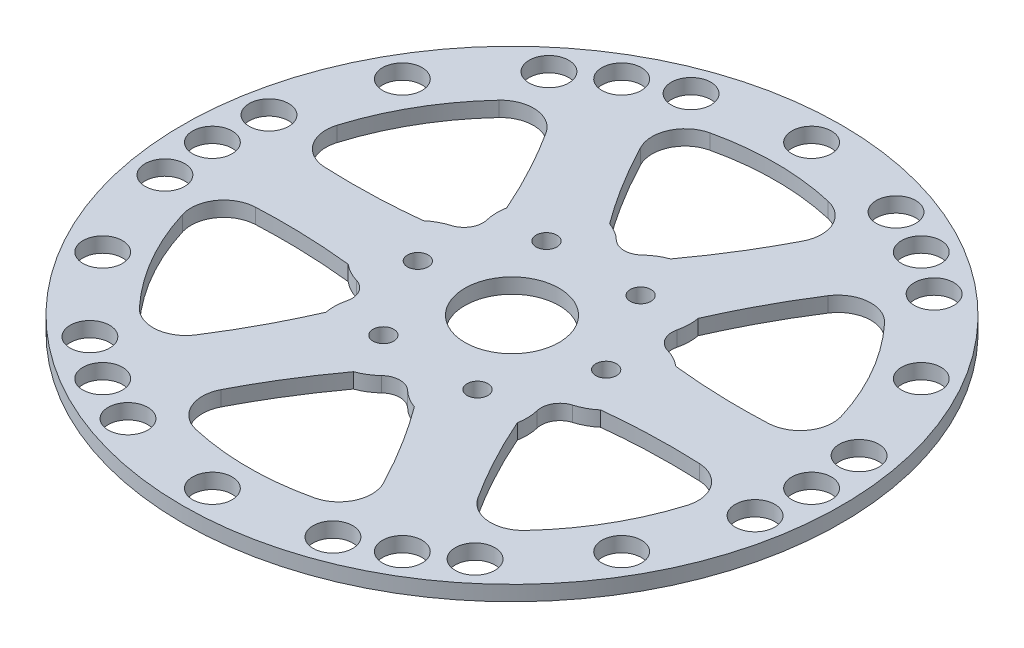
from build123d import *

# Parameters (mm, degrees)
SKETCH1_R           = 35
SKETCH1_R_2         = 5
SKETCH1_R_3         = 2.1
BOSS_EXTRUDE1_DEPTH = 1.6
BOSS_EXTRUDE2_DEPTH = 1.6
SKETCH4_R           = 1.1
CUT_EXTRUDE1_DEPTH  = 50.523327836
CUT_EXTRUDE2_DEPTH  = 50.523327836
FILLET2_R           = 2
FILLET3_R           = 2
FILLET4_R           = 2
FILLET5_R           = 2
FILLET6_R           = 2
FILLET7_R           = 2
FILLET8_R           = 3.5


with BuildPart() as part:
    # Sketch1 → Boss-Extrude1 (new body)
    with BuildSketch(Plane(origin=(0, 0, 0), x_dir=(1, 0, 0), z_dir=(0, 1, 0))):
        Circle(SKETCH1_R)
        Circle(SKETCH1_R_2, mode=Mode.SUBTRACT)
        with BuildLine():
            Line((-6.92820323, 4), (-27.712812921, 4))
            ThreePointArc((-27.712812921, 4), (-24.248711306, 14), (-17.320508076, 22))
            Line((-17.320508076, 22), (-6.92820323, 4))
        make_face(mode=Mode.SUBTRACT)
        with BuildLine():
            Line((-27.712812921, -4), (-6.92820323, -4))
            Line((-6.92820323, -4), (-17.320508076, -22))
            ThreePointArc((-17.320508076, -22), (-24.248711306, -14), (-27.712812921, -4))
        make_face(mode=Mode.SUBTRACT)
        with BuildLine():
            Line((0, 8), (-10.392304845, 26))
            ThreePointArc((-10.392304845, 26), (0, 28), (10.392304845, 26))
            Line((10.392304845, 26), (0, 8))
        make_face(mode=Mode.SUBTRACT)
        with Locations((-20.453376397, -24.375384801)):
            Circle(SKETCH1_R_3, mode=Mode.SUBTRACT)
        with Locations((-15.9099025, -27.556759473)):
            Circle(SKETCH1_R_3, mode=Mode.SUBTRACT)
        with Locations((-10.883014267, -29.900835953)):
            Circle(SKETCH1_R_3, mode=Mode.SUBTRACT)
        with Locations((-27.556759473, -15.9099025)):
            Circle(SKETCH1_R_3, mode=Mode.SUBTRACT)
        with Locations((-31.336390663, -5.525451152)):
            Circle(SKETCH1_R_3, mode=Mode.SUBTRACT)
        with Locations((0, -31.819805)):
            Circle(SKETCH1_R_3, mode=Mode.SUBTRACT)
        with Locations((10.883014267, -29.900835953)):
            Circle(SKETCH1_R_3, mode=Mode.SUBTRACT)
        with Locations((15.9099025, -27.556759473)):
            Circle(SKETCH1_R_3, mode=Mode.SUBTRACT)
        with Locations((20.453376397, -24.375384801)):
            Circle(SKETCH1_R_3, mode=Mode.SUBTRACT)
        with Locations((27.556759473, -15.9099025)):
            Circle(SKETCH1_R_3, mode=Mode.SUBTRACT)
        with Locations((31.336390663, -5.525451152)):
            Circle(SKETCH1_R_3, mode=Mode.SUBTRACT)
        with Locations((-31.819805, 0)):
            Circle(SKETCH1_R_3, mode=Mode.SUBTRACT)
        with Locations((-31.336390663, 5.525451152)):
            Circle(SKETCH1_R_3, mode=Mode.SUBTRACT)
        with Locations((-27.556759473, 15.9099025)):
            Circle(SKETCH1_R_3, mode=Mode.SUBTRACT)
        with Locations((-20.453376397, 24.375384801)):
            Circle(SKETCH1_R_3, mode=Mode.SUBTRACT)
        with Locations((-15.9099025, 27.556759473)):
            Circle(SKETCH1_R_3, mode=Mode.SUBTRACT)
        with Locations((-10.883014267, 29.900835953)):
            Circle(SKETCH1_R_3, mode=Mode.SUBTRACT)
        with Locations((20.453376397, 24.375384801)):
            Circle(SKETCH1_R_3, mode=Mode.SUBTRACT)
        with BuildLine():
            ThreePointArc((10.392304845, -26), (0, -28), (-10.392304845, -26))
            Line((-10.392304845, -26), (0, -8))
            Line((0, -8), (10.392304845, -26))
        make_face(mode=Mode.SUBTRACT)
        with BuildLine():
            ThreePointArc((27.712812921, -4), (24.248711306, -14), (17.320508076, -22))
            Line((17.320508076, -22), (6.92820323, -4))
            Line((6.92820323, -4), (27.712812921, -4))
        make_face(mode=Mode.SUBTRACT)
        with BuildLine():
            ThreePointArc((17.320508076, 22), (24.248711306, 14), (27.712812921, 4))
            Line((27.712812921, 4), (6.92820323, 4))
            Line((6.92820323, 4), (17.320508076, 22))
        make_face(mode=Mode.SUBTRACT)
        with Locations((15.9099025, 27.556759473)):
            Circle(SKETCH1_R_3, mode=Mode.SUBTRACT)
        with Locations((31.819805, 0)):
            Circle(SKETCH1_R_3, mode=Mode.SUBTRACT)
        with Locations((31.336390663, 5.525451152)):
            Circle(SKETCH1_R_3, mode=Mode.SUBTRACT)
        with Locations((27.556759473, 15.9099025)):
            Circle(SKETCH1_R_3, mode=Mode.SUBTRACT)
        with Locations((0, 31.819805)):
            Circle(SKETCH1_R_3, mode=Mode.SUBTRACT)
        with Locations((10.883014267, 29.900835953)):
            Circle(SKETCH1_R_3, mode=Mode.SUBTRACT)
    extrude(amount=BOSS_EXTRUDE1_DEPTH)

    # Sketch3 → Boss-Extrude2 (add)
    with BuildSketch(Plane(origin=(0, 1.6, 0), x_dir=(1, 0, 0), z_dir=(0, 1, 0))):
        with BuildLine():
            Line((-6.92820323, 4), (-10.164285429, 9.605058785))
            ThreePointArc((-10.164285429, 9.605058785), (-10.04814136, 7.218460428), (-8.886317063, 5.130517549))
            ThreePointArc((-8.886317063, 5.130517549), (-11.275440787, 5.092715464), (-13.400367627, 4))
            Line((-13.400367627, 4), (-6.92820323, 4))
        make_face()
        with BuildLine():
            Line((-10.164285429, -9.605058785), (-6.92820323, -4))
            Line((-6.92820323, -4), (-13.400367627, -4))
            ThreePointArc((-13.400367627, -4), (-11.275440787, -5.092715464), (-8.886317063, -5.130517549))
            ThreePointArc((-8.886317063, -5.130517549), (-10.04814136, -7.218460428), (-10.164285429, -9.605058785))
        make_face()
        with BuildLine():
            Line((0, 8), (3.236082198, 13.605058785))
            ThreePointArc((3.236082198, 13.605058785), (1.227299427, 12.311175892), (0, 10.261035097))
            ThreePointArc((0, 10.261035097), (-1.227299427, 12.311175892), (-3.236082198, 13.605058785))
            Line((-3.236082198, 13.605058785), (0, 8))
        make_face()
        with BuildLine():
            Line((0, -8), (-3.236082198, -13.605058785))
            ThreePointArc((-3.236082198, -13.605058785), (-1.227299427, -12.311175892), (0, -10.261035097))
            ThreePointArc((0, -10.261035097), (1.227299427, -12.311175892), (3.236082198, -13.605058785))
            Line((3.236082198, -13.605058785), (0, -8))
        make_face()
        with BuildLine():
            Line((6.92820323, 4), (13.400367627, 4))
            ThreePointArc((13.400367627, 4), (11.275440787, 5.092715464), (8.886317063, 5.130517549))
            ThreePointArc((8.886317063, 5.130517549), (10.04814136, 7.218460428), (10.164285429, 9.605058785))
            Line((10.164285429, 9.605058785), (6.92820323, 4))
        make_face()
        with BuildLine():
            Line((6.92820323, -4), (10.164285429, -9.605058785))
            ThreePointArc((10.164285429, -9.605058785), (10.04814136, -7.218460428), (8.886317063, -5.130517549))
            ThreePointArc((8.886317063, -5.130517549), (11.275440787, -5.092715464), (13.400367627, -4))
            Line((13.400367627, -4), (6.92820323, -4))
        make_face()
    extrude(amount=-BOSS_EXTRUDE2_DEPTH)

    # Sketch4 → Cut-Extrude1 (cut, through all)
    with BuildSketch(Plane(origin=(0, 1.6, 0), x_dir=(1, 0, 0), z_dir=(0, 1, 0))):
        with Locations((-10, 0)):
            Circle(SKETCH4_R)
        with Locations((-5, 8.660254038)):
            Circle(SKETCH4_R)
        with Locations((5, 8.660254038)):
            Circle(SKETCH4_R)
        with Locations((10, 0)):
            Circle(SKETCH4_R)
        with Locations((5, -8.660254038)):
            Circle(SKETCH4_R)
        with Locations((-5, -8.660254038)):
            Circle(SKETCH4_R)
    extrude(amount=-CUT_EXTRUDE1_DEPTH, mode=Mode.SUBTRACT)

    # Sketch5 → Cut-Extrude2 (cut, through all)
    with BuildSketch(Plane(origin=(0, 1.6, 0), x_dir=(1, 0, 0), z_dir=(0, 1, 0))):
        with BuildLine():
            Line((-17.320508076, 22), (-27.712812921, 4))
            add(Edge.make_bspline(
                [(-27.712812921, 4), (-20.55684118, 3.21852091), (-13.400367627, 4)],
                knots=[0, 0, 0, 1, 1, 1], degree=2))
            Line((-13.400367627, 4), (-10.164285429, 9.605058785))
            add(Edge.make_bspline(
                [(-17.320508076, 22), (-13.058338502, 16.197470607), (-10.164285429, 9.605058785)],
                knots=[0, 0, 0, 1, 1, 1], degree=2))
        make_face()
        with BuildLine():
            Line((-3.236082198, 13.605058785), (3.236082198, 13.605058785))
            add(Edge.make_bspline(
                [(10.392304845, 26), (7.498251772, 19.407588178), (3.236082198, 13.605058785)],
                knots=[0, 0, 0, 1, 1, 1], degree=2))
            Line((10.392304845, 26), (-10.392304845, 26))
            add(Edge.make_bspline(
                [(-10.392304845, 26), (-7.491099719, 19.412007138), (-3.236082198, 13.605058785)],
                knots=[0, 0, 0, 1, 1, 1], degree=2))
        make_face()
        with BuildLine():
            Line((10.164285429, 9.605058785), (13.400367627, 4))
            add(Edge.make_bspline(
                [(27.712812921, 4), (20.556590274, 3.21011757), (13.400367627, 4)],
                knots=[0, 0, 0, 1, 1, 1], degree=2))
            Line((27.712812921, 4), (17.320508076, 22))
            add(Edge.make_bspline(
                [(17.320508076, 22), (13.065741461, 16.193486228), (10.164285429, 9.605058785)],
                knots=[0, 0, 0, 1, 1, 1], degree=2))
        make_face()
        with BuildLine():
            Line((13.400367627, -4), (10.164285429, -9.605058785))
            add(Edge.make_bspline(
                [(17.320508076, -22), (13.058338502, -16.197470607), (10.164285429, -9.605058785)],
                knots=[0, 0, 0, 1, 1, 1], degree=2))
            Line((17.320508076, -22), (27.712812921, -4))
            add(Edge.make_bspline(
                [(27.712812921, -4), (20.55684118, -3.21852091), (13.400367627, -4)],
                knots=[0, 0, 0, 1, 1, 1], degree=2))
        make_face()
        with BuildLine():
            Line((3.236082198, -13.605058785), (-3.236082198, -13.605058785))
            add(Edge.make_bspline(
                [(-10.392304845, -26), (-7.498251772, -19.407588178), (-3.236082198, -13.605058785)],
                knots=[0, 0, 0, 1, 1, 1], degree=2))
            Line((-10.392304845, -26), (10.392304845, -26))
            add(Edge.make_bspline(
                [(10.392304845, -26), (7.491099719, -19.412007138), (3.236082198, -13.605058785)],
                knots=[0, 0, 0, 1, 1, 1], degree=2))
        make_face()
        with BuildLine():
            Line((-10.164285429, -9.605058785), (-13.400367627, -4))
            add(Edge.make_bspline(
                [(-27.712812921, -4), (-20.556590274, -3.21011757), (-13.400367627, -4)],
                knots=[0, 0, 0, 1, 1, 1], degree=2))
            Line((-27.712812921, -4), (-17.320508076, -22))
            add(Edge.make_bspline(
                [(-17.320508076, -22), (-13.065741461, -16.193486228), (-10.164285429, -9.605058785)],
                knots=[0, 0, 0, 1, 1, 1], degree=2))
        make_face()
    extrude(amount=-CUT_EXTRUDE2_DEPTH, mode=Mode.SUBTRACT)

    # Fillet2
    fillet2_edges = [part.edges().sort_by_distance(p)[0] for p in [
        (0, 0.8, -10.261035097),
    ]]
    fillet(fillet2_edges, radius=FILLET2_R)

    # Fillet3
    fillet3_edges = [part.edges().sort_by_distance(p)[0] for p in [
        (-8.886317063, 0.8, -5.130517549),
    ]]
    fillet(fillet3_edges, radius=FILLET3_R)

    # Fillet4
    fillet4_edges = [part.edges().sort_by_distance(p)[0] for p in [
        (8.886317063, 0.8, -5.130517549),
    ]]
    fillet(fillet4_edges, radius=FILLET4_R)

    # Fillet5
    fillet5_edges = [part.edges().sort_by_distance(p)[0] for p in [
        (8.886317063, 0.8, 5.130517549),
    ]]
    fillet(fillet5_edges, radius=FILLET5_R)

    # Fillet6
    fillet6_edges = [part.edges().sort_by_distance(p)[0] for p in [
        (0, 0.8, 10.261035097),
    ]]
    fillet(fillet6_edges, radius=FILLET6_R)

    # Fillet7
    fillet7_edges = [part.edges().sort_by_distance(p)[0] for p in [
        (-8.886317063, 0.8, 5.130517549),
    ]]
    fillet(fillet7_edges, radius=FILLET7_R)

    # Fillet8
    fillet8_edges = [part.edges().sort_by_distance(p)[0] for p in [
        (17.320508076, 0.8, -22),
        (27.712812921, 0.8, -4),
        (27.712812921, 0.8, 4),
        (17.320508076, 0.8, 22),
        (10.392304845, 0.8, 26),
        (-10.392304845, 0.8, 26),
        (-17.320508076, 0.8, 22),
        (-27.712812921, 0.8, 4),
        (-27.712812921, 0.8, -4),
        (-17.320508076, 0.8, -22),
        (10.392304845, 0.8, -26),
        (-10.392304845, 0.8, -26),
    ]]
    fillet(fillet8_edges, radius=FILLET8_R)


solid = part.part
